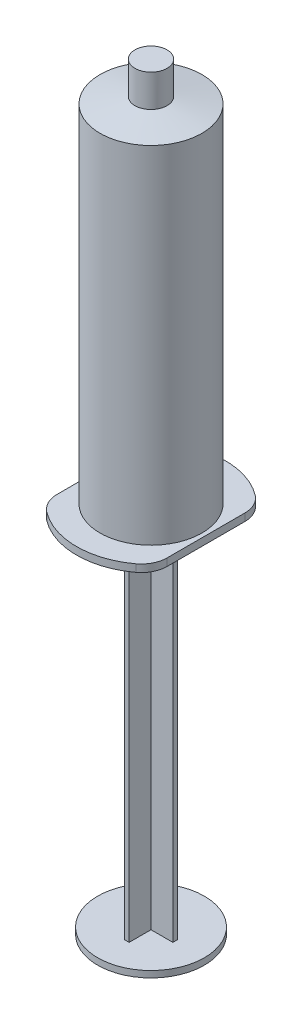
from build123d import *

# Parameters (mm, degrees)
SKETCH1_R           = 15.75
BOSS_EXTRUDE1_DEPTH = 109
CHAMFER1_SIZE       = 2
CHAMFER1_SIZE2      = 10.791034349
SKETCH2_R           = 4.958965651
BOSS_EXTRUDE2_DEPTH = 10
BOSS_EXTRUDE3_DEPTH = 2.3
BOSS_EXTRUDE4_DEPTH = 111
SKETCH5_R           = 16.5
BOSS_EXTRUDE5_DEPTH = 2


with BuildPart() as part:
    # Sketch1 → Boss-Extrude1 (new body)
    with BuildSketch(Plane(origin=(0, 0, 0), x_dir=(1, 0, 0), z_dir=(0, 1, 0))):
        with Locations(Location((0, 0, 0), (0, 0, 270))):
            Circle(SKETCH1_R)
    extrude(amount=BOSS_EXTRUDE1_DEPTH)

    # Chamfer1
    chamfer1_edges = [part.edges().sort_by_distance(p)[0] for p in [
        (0, 109, -15.75),
    ]]
    chamfer1_side = [part.faces().sort_by_distance(p)[0] for p in [
        (0, 54.5, -15.75),
    ]]
    chamfer(chamfer1_edges, length=CHAMFER1_SIZE, length2=CHAMFER1_SIZE2, reference=chamfer1_side[0])

    # Sketch2 → Boss-Extrude2 (add)
    with BuildSketch(Plane(origin=(0, 109, 0), x_dir=(1, 0, 0), z_dir=(0, 1, 0))):
        with Locations(Location((0, 0, 0), (0, 0, 90))):
            Circle(SKETCH2_R)
    extrude(amount=BOSS_EXTRUDE2_DEPTH)

    # Sketch3 → Boss-Extrude3 (add)
    with BuildSketch(Plane.XZ):
        with BuildLine():
            Line((-17, 12), (-17, -12))
            ThreePointArc((-17, -12), (-16.155417528, -15.577708764), (-13.8, -18.4))
            ThreePointArc((-13.8, -18.4), (0, -23), (13.8, -18.4))
            ThreePointArc((13.8, -18.4), (16.155417528, -15.577708764), (17, -12))
            Line((17, -12), (17, 12))
            ThreePointArc((17, 12), (16.155417528, 15.577708764), (13.8, 18.4))
            ThreePointArc((13.8, 18.4), (0, 23), (-13.8, 18.4))
            ThreePointArc((-13.8, 18.4), (-16.155417528, 15.577708764), (-17, 12))
        make_face()
    extrude(amount=BOSS_EXTRUDE3_DEPTH)

    # Sketch4 → Boss-Extrude4 (add)
    with BuildSketch(Plane.XZ.offset(2.3)):
        Polygon((0.75, 0.75), (7.5, 0.75), (7.5, -0.75), (0.75, -0.75), (0.75, -7.5), (-0.75, -7.5), (-0.75, -0.75), (-7.5, -0.75), (-7.5, 0.75), (-0.75, 0.75), (-0.75, 7.5), (0.75, 7.5), align=None)
    extrude(amount=BOSS_EXTRUDE4_DEPTH)

    # Sketch5 → Boss-Extrude5 (add)
    with BuildSketch(Plane.XZ.offset(113.3)):
        with Locations(Location((0, 0, 0), (0, 0, 270))):
            Circle(SKETCH5_R)
    extrude(amount=BOSS_EXTRUDE5_DEPTH)


solid = part.part
